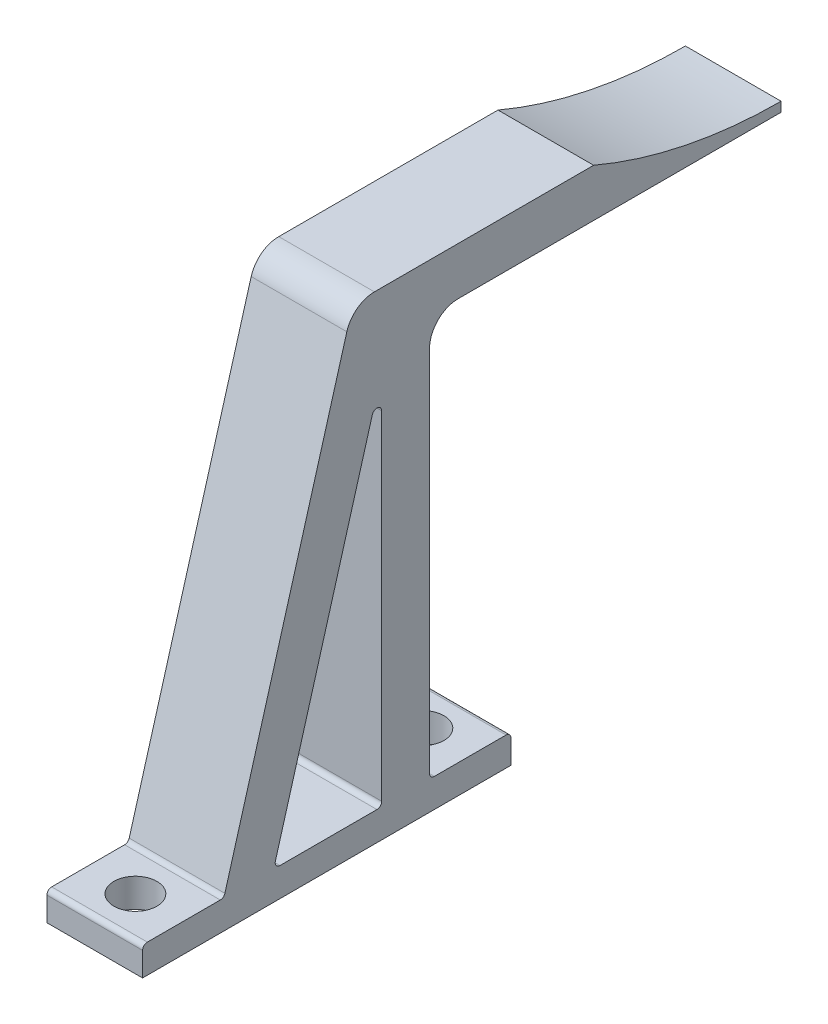
from build123d import *

# Parameters (mm, degrees)
BOSS_EXTRUDE1_DEPTH = 10
SKETCH1_5_OUTSIDE_W = 85.55
SKETCH1_5_OUTSIDE_H = 68.8
CUT_EXTRUDE2_DEPTH  = 10
SKETCH5_R           = 2.25
CUT_EXTRUDE3_DEPTH  = 10


with BuildPart() as part:
    # Sketch1 → Boss-Extrude1 (new body)
    with BuildSketch(Plane(origin=(0, 0, 0), x_dir=(0, 0, -1), z_dir=(1, 0, 0))):
        with BuildLine():
            Line((7.980196803, 33.697050156), (-4.769859567, -10.767680589))
            ThreePointArc((-4.769859567, -10.767680589), (-4.949582903, -11.029179666), (-5.250490415, -11.129861911))
            Line((-5.250490415, -11.129861911), (-12.87371339, -11.129861911))
            ThreePointArc((-12.87371339, -11.129861911), (-13.227266781, -11.276308521), (-13.37371339, -11.629861911))
            Line((-13.37371339, -11.629861911), (-13.37371339, -14.129861911))
            Line((-13.37371339, -14.129861911), (25.12628661, -14.129861911))
            Line((25.12628661, -14.129861911), (25.12628661, -11.629861911))
            ThreePointArc((25.12628661, -11.629861911), (24.979840001, -11.276308521), (24.62628661, -11.129861911))
            Line((24.62628661, -11.129861911), (17.12628661, -11.129861911))
            ThreePointArc((17.12628661, -11.129861911), (16.772733219, -10.983415302), (16.62628661, -10.629861911))
            Line((16.62628661, -10.629861911), (16.62628661, 27.870138089))
            ThreePointArc((16.62628661, 27.870138089), (17.504966266, 29.991458432), (19.62628661, 30.870138089))
            Line((19.62628661, 30.870138089), (53.37628661, 30.870138089))
            Line((53.37628661, 30.870138089), (53.37628661, 31.870138089))
            ThreePointArc((53.37628661, 31.870138089), (43.37628661, 32.880343233), (33.780368668, 35.870138089))
            Line((33.780368668, 35.870138089), (10.863981891, 35.870138089))
            ThreePointArc((10.863981891, 35.870138089), (9.058536822, 35.266044619), (7.980196803, 33.697050156))
        make_face()
    extrude(amount=BOSS_EXTRUDE1_DEPTH)

    # Sketch1<5> outside → Cut-Extrude2 (cut)
    # profile 1 of 2: a face of its own
    with BuildSketch(Plane(origin=(0, 0, 0), x_dir=(0, 0, -1), z_dir=(1, 0, 0))):
        with Locations((20.001, 10.87)):
            Rectangle(SKETCH1_5_OUTSIDE_W, SKETCH1_5_OUTSIDE_H)
        with BuildLine():
            Line((7.980196803, 33.697050156), (-4.769859567, -10.767680589))
            ThreePointArc((-4.769859567, -10.767680589), (-4.949582903, -11.029179666), (-5.250490415, -11.129861911))
            Line((-5.250490415, -11.129861911), (-12.87371339, -11.129861911))
            ThreePointArc((-12.87371339, -11.129861911), (-13.227266781, -11.276308521), (-13.37371339, -11.629861911))
            Line((-13.37371339, -11.629861911), (-13.37371339, -14.129861911))
            Line((-13.37371339, -14.129861911), (25.12628661, -14.129861911))
            Line((25.12628661, -14.129861911), (25.12628661, -11.629861911))
            ThreePointArc((25.12628661, -11.629861911), (24.979840001, -11.276308521), (24.62628661, -11.129861911))
            Line((24.62628661, -11.129861911), (17.12628661, -11.129861911))
            ThreePointArc((17.12628661, -11.129861911), (16.772733219, -10.983415302), (16.62628661, -10.629861911))
            Line((16.62628661, -10.629861911), (16.62628661, 27.870138089))
            ThreePointArc((16.62628661, 27.870138089), (17.504966266, 29.991458432), (19.62628661, 30.870138089))
            Line((19.62628661, 30.870138089), (53.37628661, 30.870138089))
            Line((53.37628661, 30.870138089), (53.37628661, 31.870138089))
            ThreePointArc((53.37628661, 31.870138089), (43.37628661, 32.880343233), (33.780368668, 35.870138089))
            Line((33.780368668, 35.870138089), (10.863981891, 35.870138089))
            ThreePointArc((10.863981891, 35.870138089), (9.058536822, 35.266044619), (7.980196803, 33.697050156))
        make_face(mode=Mode.SUBTRACT)
    # profile 2 of 2: a face of its own
    with BuildSketch(Plane(origin=(0, 0, 0), x_dir=(0, 0, -1), z_dir=(1, 0, 0))):
        with BuildLine():
            Line((0.9913062, -11.129861911), (11.12628661, -11.129861911))
            ThreePointArc((11.12628661, -11.129861911), (11.479840001, -10.983415302), (11.62628661, -10.629861911))
            Line((11.62628661, -10.629861911), (11.62628661, 24.715015158))
            ThreePointArc((11.62628661, 24.715015158), (11.195873161, 25.210149192), (10.645655762, 24.852833836))
            Line((10.645655762, 24.852833836), (0.510675352, -10.492043234))
            ThreePointArc((0.510675352, -10.492043234), (0.591988445, -10.930769423), (0.9913062, -11.129861911))
        make_face()
    extrude(amount=CUT_EXTRUDE2_DEPTH, mode=Mode.SUBTRACT)

    # Sketch5 → Cut-Extrude3 (cut)
    with BuildSketch(Plane.XZ.offset(14.129861911)):
        with Locations((5, 9.12371339)):
            Circle(SKETCH5_R)
        with Locations((5, -20.87628661)):
            Circle(SKETCH5_R)
    extrude(amount=-CUT_EXTRUDE3_DEPTH, mode=Mode.SUBTRACT)


solid = part.part
